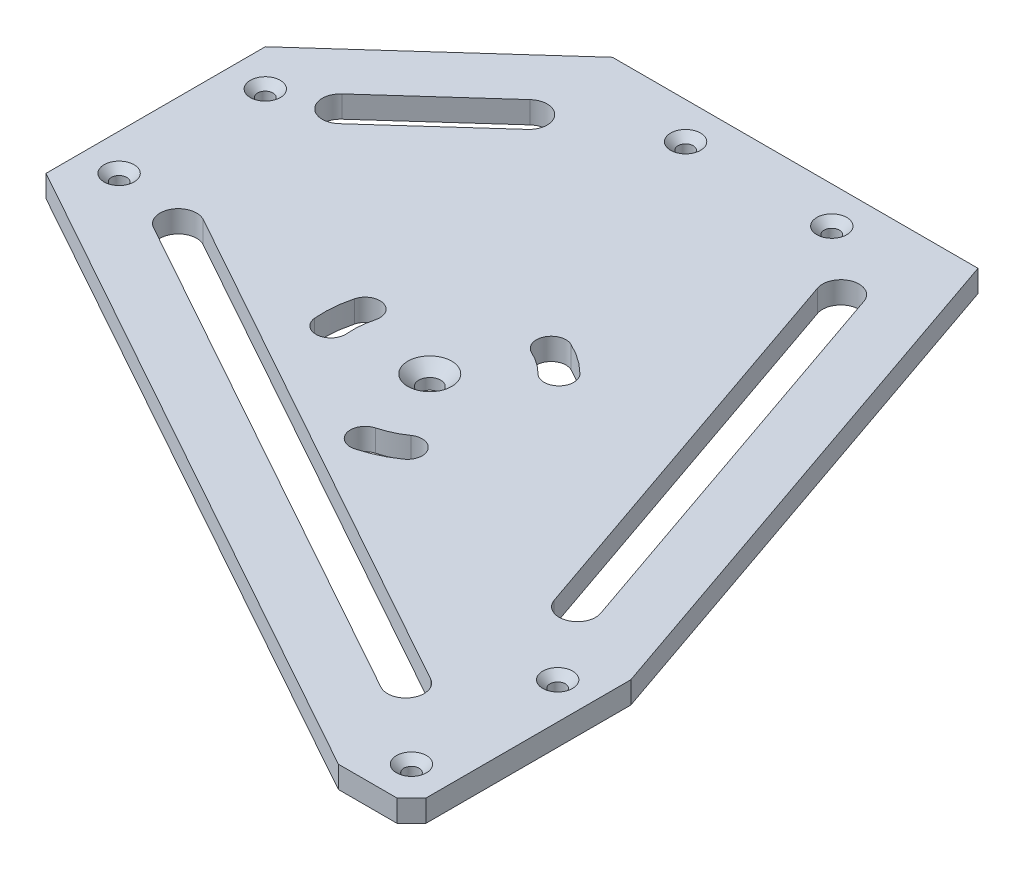
from build123d import *

# Parameters (mm, degrees)
SKETCH_1_R               = 3
SKETCH_1_R_2             = 2.1
EXTRUDE_1_DEPTH          = 3
CHAMFER_1_SIZE           = 2
CHAMFER_3_SIZE           = 4
CUT_EXTRUDE_1_DEPTH      = 146.124084838
CHAMFER_4_SIZE           = 3
CUT_EXTRUDE_2_DEPTH      = 146.124084838
PATTERN_CIRCULAR_1_COUNT = 3


with BuildPart() as part:
    # 草图1 → 凸台-拉伸1 (new, symmetric)
    with BuildSketch(Plane(origin=(0, 0, 0), x_dir=(1, 0, 0), z_dir=(0, 1, 0))):
        Polygon((-50, 100), (50, 100), (100, -45), (100, -105), (80, -105), (-100, -5), (-100, 55), align=None)
        with Locations(Location((0, 0, 0), (0, 0, 270))):
            Circle(SKETCH_1_R, mode=Mode.SUBTRACT)
        with Locations(Location((-20, 90, 0), (0, 0, 270))):
            Circle(SKETCH_1_R_2, mode=Mode.SUBTRACT)
        with Locations(Location((-90, 45, 0), (0, 0, 270))):
            Circle(SKETCH_1_R_2, mode=Mode.SUBTRACT)
        with Locations(Location((-90, 5, 0), (0, 0, 270))):
            Circle(SKETCH_1_R_2, mode=Mode.SUBTRACT)
        with Locations(Location((20, 90, 0), (0, 0, 90))):
            Circle(SKETCH_1_R_2, mode=Mode.SUBTRACT)
        with Locations(Location((90, -55, 0), (0, 0, 270))):
            Circle(SKETCH_1_R_2, mode=Mode.SUBTRACT)
        with Locations(Location((90, -95, 0), (0, 0, 270))):
            Circle(SKETCH_1_R_2, mode=Mode.SUBTRACT)
    extrude(amount=EXTRUDE_1_DEPTH, both=True)

    # 倒角1
    chamfer_1_edges = [part.edges().sort_by_distance(p)[0] for p in [
        (-20, 3, -92.1),
        (-90, 3, -47.1),
        (-90, 3, -7.1),
        (90, 3, 52.9),
        (90, 3, 92.9),
        (20, 3, -87.9),
    ]]
    chamfer(chamfer_1_edges, length=CHAMFER_1_SIZE)

    # 倒角3
    chamfer_3_edges = [part.edges().sort_by_distance(p)[0] for p in [
        (100, 0, 105),
    ]]
    chamfer(chamfer_3_edges, length=CHAMFER_3_SIZE)

    # 草图2 → 切除-拉伸1 (cut, through all)
    with BuildSketch(Plane(origin=(0, 3, 0), x_dir=(1, 0, 0), z_dir=(0, 1, 0))):
        with BuildLine():
            Line((-78.344823658, 54.309222637), (-51.225659109, 78.716470731))
            ThreePointArc((-51.225659109, 78.716470731), (-44.16436472, 78.344823658), (-44.536011793, 71.283529269))
            Line((-44.536011793, 71.283529269), (-71.655176342, 46.876281175))
            ThreePointArc((-71.655176342, 46.876281175), (-78.716470731, 47.247928248), (-78.344823658, 54.309222637))
        make_face()
        with BuildLine():
            Line((70.669187988, -36.629953417), (32.738153505, 73.370046583))
            ThreePointArc((32.738153505, 73.370046583), (35.835064997, 79.726864908), (42.191883322, 76.629953417))
            Line((42.191883322, 76.629953417), (80.122917804, -33.370046583))
            ThreePointArc((80.122917804, -33.370046583), (77.026006313, -39.726864908), (70.669187988, -36.629953417))
        make_face()
        with BuildLine():
            Line((67.571785344, -80.936052734), (-72.428214656, -3.158274956))
            ThreePointArc((-72.428214656, -3.158274956), (-74.370786381, 3.64072608), (-67.571785344, 5.583297805))
            Line((-67.571785344, 5.583297805), (72.428214656, -72.194479973))
            ThreePointArc((72.428214656, -72.194479973), (74.370786381, -78.993481009), (67.571785344, -80.936052734))
        make_face()
    extrude(amount=-CUT_EXTRUDE_1_DEPTH, mode=Mode.SUBTRACT)

    # 倒角4
    chamfer_4_edges = [part.edges().sort_by_distance(p)[0] for p in [
        (0, 3, -3),
    ]]
    chamfer(chamfer_4_edges, length=CHAMFER_4_SIZE)

    # 草图3 → 切除-拉伸2 (cut, through all)
    with BuildSketch(Plane(origin=(0, 3, 0), x_dir=(1, 0, 0), z_dir=(0, 1, 0))):
        with BuildLine():
            ThreePointArc((20.541451993, 20.541451993), (16.662395476, 23.796366887), (12.277060504, 26.328241213))
            ThreePointArc((12.277060504, 26.328241213), (6.894910006, 24.369298636), (8.853852583, 18.987148138))
            ThreePointArc((8.853852583, 18.987148138), (12.016426342, 17.161235328), (14.813887066, 14.813887066))
            ThreePointArc((14.813887066, 14.813887066), (20.541451993, 14.813887066), (20.541451993, 20.541451993))
        make_face()
    cut_extrude_2 = extrude(amount=-CUT_EXTRUDE_2_DEPTH, mode=Mode.SUBTRACT)

    # 阵列(圆周)1: 切除-拉伸2 ×3 about axis
    pattern_circular_1_axis = Axis((0, 0, 0), (0, 1, 0))
    for i in range(1, PATTERN_CIRCULAR_1_COUNT):
        add(cut_extrude_2.rotate(pattern_circular_1_axis, i * 360 / PATTERN_CIRCULAR_1_COUNT), mode=Mode.SUBTRACT)


solid = part.part
